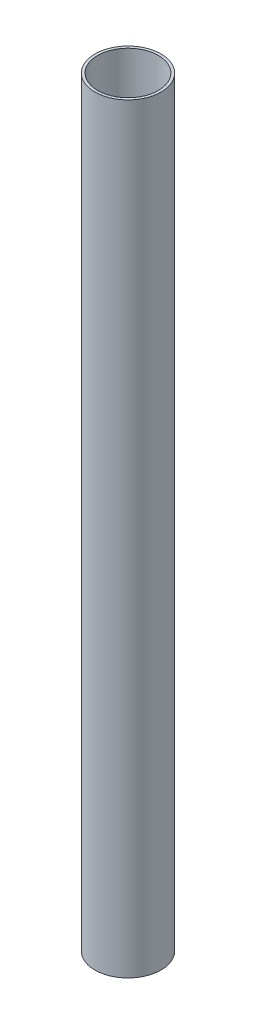
from build123d import *

# Parameters (mm, degrees)
SKETCH1_R           = 0.62
SKETCH1_R_2         = 0.57
BOSS_EXTRUDE1_DEPTH = 14.27


with BuildPart() as part:
    # Sketch1 → Boss-Extrude1 (new body)
    with BuildSketch(Plane(origin=(0, 0, 0), x_dir=(1, 0, 0), z_dir=(0, 1, 0))):
        with Locations(Location((0, 0, 0), (0, 0, 270))):
            Circle(SKETCH1_R)
        with Locations(Location((0, 0, 0), (0, 0, 270))):
            Circle(SKETCH1_R_2, mode=Mode.SUBTRACT)
    extrude(amount=BOSS_EXTRUDE1_DEPTH)


solid = part.part
